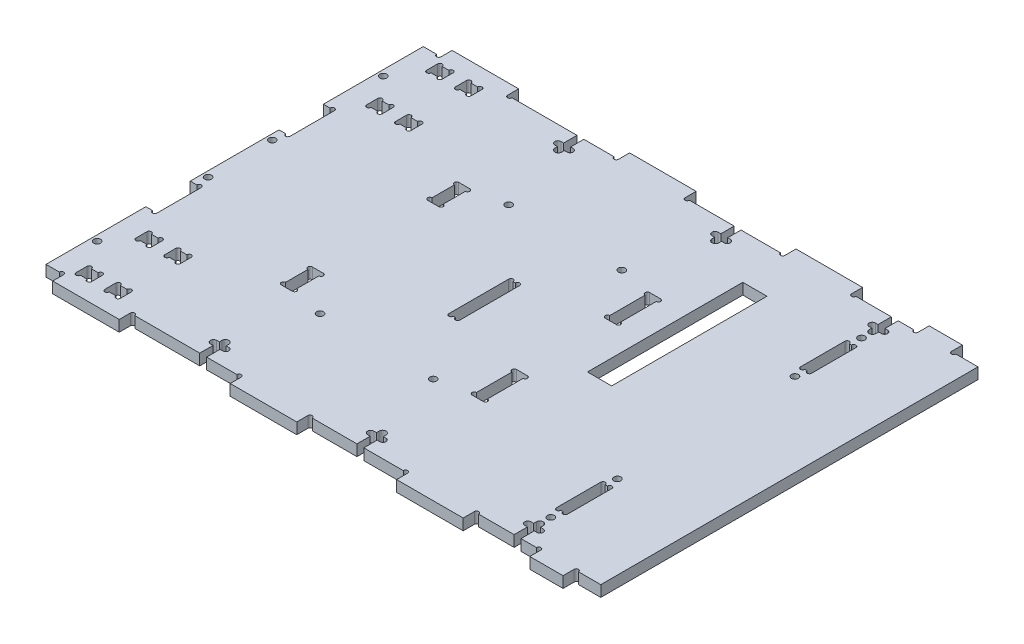
from build123d import *

# Parameters (mm, degrees)
SKETCH_1_W           = 250
SKETCH_1_H           = 170
EXTRUDE_1_DEPTH      = 5
SKETCH_2_W           = 5
SKETCH_2_H           = 27
SKETCH_2_H_2         = 20
CUT_EXTRUDE_1_DEPTH  = 10
SKETCH_3_R           = 1.55
CUT_EXTRUDE_2_DEPTH  = 10
SKETCH_4_W           = 5
SKETCH_4_H           = 20
CUT_EXTRUDE_3_DEPTH  = 5
SKETCH_5_R           = 1
CUT_EXTRUDE_4_DEPTH  = 10
CUT_EXTRUDE_5_DEPTH  = 10
SKETCH_8_W           = 30
SKETCH_8_H           = 5
SKETCH_8_W_2         = 15
EXTRUDE_2_DEPTH      = 5
SKETCH_9_R           = 1
CUT_EXTRUDE_6_DEPTH  = 5
SKETCH_13_W          = 7
SKETCH_13_H          = 5
CUT_EXTRUDE_9_DEPTH  = 10
SKETCH_14_R          = 1
CUT_EXTRUDE_10_DEPTH = 10
SKETCH_15_W          = 5
SKETCH_15_H          = 14
SKETCH_15_H_2        = 20
CUT_EXTRUDE_11_DEPTH = 10
SKETCH_16_R          = 1
CUT_EXTRUDE_12_DEPTH = 10
SKETCH_17_W          = 10.9
SKETCH_17_H          = 70
CUT_EXTRUDE_13_DEPTH = 10


with BuildPart() as part:
    # 스케치1 → 보스-돌출1 (new body)
    with BuildSketch(Plane(origin=(0, 0, 0), x_dir=(1, 0, 0), z_dir=(0, 1, 0))):
        with Locations((125, 85)):
            Rectangle(SKETCH_1_W, SKETCH_1_H)
    extrude(amount=EXTRUDE_1_DEPTH)

    # 스케치2 → 컷-돌출1 (cut)
    with BuildSketch(Plane.XZ):
        with Locations((112.5, -85)):
            Rectangle(SKETCH_2_W, SKETCH_2_H)
        with Locations((212.5, -30)):
            Rectangle(SKETCH_2_W, SKETCH_2_H_2)
        with Locations((212.5, -140)):
            Rectangle(SKETCH_2_W, SKETCH_2_H_2)
    extrude(amount=-CUT_EXTRUDE_1_DEPTH, mode=Mode.SUBTRACT)

    # 스케치3 → 컷-돌출2 (cut)
    with BuildSketch(Plane(origin=(0, 5, 0), x_dir=(1, 0, 0), z_dir=(0, 1, 0))):
        with Locations(Location((81, 127.5, 0), (0, 0, 270))):
            Circle(SKETCH_3_R)
        with Locations(Location((132, 127.5, 0), (0, 0, 270))):
            Circle(SKETCH_3_R)
        with Locations(Location((132, 42.5, 0), (0, 0, 270))):
            Circle(SKETCH_3_R)
        with Locations(Location((81, 42.5, 0), (0, 0, 270))):
            Circle(SKETCH_3_R)
        with Locations(Location((2.5, 70.55, 0), (0, 0, 270))):
            Circle(SKETCH_3_R)
        with Locations(Location((2.5, 20.55, 0), (0, 0, 270))):
            Circle(SKETCH_3_R)
        with Locations(Location((2.5, 99.45, 0), (0, 0, 270))):
            Circle(SKETCH_3_R)
        with Locations(Location((2.5, 149.45, 0), (0, 0, 270))):
            Circle(SKETCH_3_R)
        with Locations(Location((212.5, 155, 0), (0, 0, 270))):
            Circle(SKETCH_3_R)
        with Locations(Location((212.5, 125, 0), (0, 0, 270))):
            Circle(SKETCH_3_R)
        with Locations(Location((212.5, 15, 0), (0, 0, 270))):
            Circle(SKETCH_3_R)
        with Locations(Location((212.5, 45, 0), (0, 0, 270))):
            Circle(SKETCH_3_R)
    extrude(amount=-CUT_EXTRUDE_2_DEPTH, mode=Mode.SUBTRACT)

    # 스케치4 → 컷-돌출3 (cut)
    with BuildSketch(Plane.XZ):
        with Locations((2.5, -115)):
            Rectangle(SKETCH_4_W, SKETCH_4_H)
        with Locations((2.5, -55)):
            Rectangle(SKETCH_4_W, SKETCH_4_H)
    extrude(amount=-CUT_EXTRUDE_3_DEPTH, mode=Mode.SUBTRACT)

    # 스케치5 → 컷-돌출4 (cut)
    with BuildSketch(Plane.XZ):
        with Locations((4, -45)):
            Circle(SKETCH_5_R)
        with Locations((4, -65)):
            Circle(SKETCH_5_R)
        with Locations((4, -105)):
            Circle(SKETCH_5_R)
        with Locations((4, -125)):
            Circle(SKETCH_5_R)
        with Locations((114, -98.5)):
            Circle(SKETCH_5_R)
        with Locations((111, -98.5)):
            Circle(SKETCH_5_R)
        with Locations((114, -71.5)):
            Circle(SKETCH_5_R)
        with Locations((111, -71.5)):
            Circle(SKETCH_5_R)
        with Locations((214, -20)):
            Circle(SKETCH_5_R)
        with Locations((211, -20)):
            Circle(SKETCH_5_R)
        with Locations((214, -40)):
            Circle(SKETCH_5_R)
        with Locations((211, -40)):
            Circle(SKETCH_5_R)
        with Locations((214, -130)):
            Circle(SKETCH_5_R)
        with Locations((211, -130)):
            Circle(SKETCH_5_R)
        with Locations((214, -150)):
            Circle(SKETCH_5_R)
        with Locations((211, -150)):
            Circle(SKETCH_5_R)
    extrude(amount=-CUT_EXTRUDE_4_DEPTH, mode=Mode.SUBTRACT)

    # 스케치7 → 컷-돌출5 (cut)
    with BuildSketch(Plane.XZ):
        with BuildLine():
            Line((215.25, -8.8), (214.05, -8.8))
            Line((214.05, -8.8), (214.05, -9.999999282))
            ThreePointArc((214.05, -9.999999282), (212.500000359, -11.549999641), (210.95, -10))
            Line((210.95, -10), (210.95, -8.8))
            Line((210.95, -8.8), (209.75, -8.8))
            ThreePointArc((209.75, -8.8), (208.35, -7.4), (209.75, -6))
            Line((209.75, -6), (210.95, -6))
            Line((210.95, -6), (210.95, 0))
            Line((210.95, 0), (214.05, 0))
            Line((214.05, 0), (214.05, -6))
            Line((214.05, -6), (215.25, -6))
            ThreePointArc((215.25, -6), (216.65, -7.4), (215.25, -8.8))
        make_face()
        with BuildLine():
            Line((73.583333333, -8.8), (72.383333333, -8.8))
            Line((72.383333333, -8.8), (72.383333333, -10))
            ThreePointArc((72.383333333, -10), (70.833333333, -11.55), (69.283333333, -10))
            Line((69.283333333, -10), (69.283333333, -8.8))
            Line((69.283333333, -8.8), (68.083333333, -8.8))
            ThreePointArc((68.083333333, -8.8), (66.683333333, -7.4), (68.083333333, -6))
            Line((68.083333333, -6), (69.283333333, -6))
            Line((69.283333333, -6), (69.283333333, 0))
            Line((69.283333333, 0), (72.383333333, 0))
            Line((72.383333333, 0), (72.383333333, -6))
            Line((72.383333333, -6), (73.583333333, -6))
            ThreePointArc((73.583333333, -6), (74.983333333, -7.4), (73.583333333, -8.8))
        make_face()
        with BuildLine():
            Line((144.416666667, -8.8), (143.216666667, -8.8))
            Line((143.216666667, -8.8), (143.216666667, -10))
            ThreePointArc((143.216666667, -10), (141.666666667, -11.55), (140.116666667, -10))
            Line((140.116666667, -10), (140.116666667, -8.8))
            Line((140.116666667, -8.8), (138.916666667, -8.8))
            ThreePointArc((138.916666667, -8.8), (137.516666667, -7.4), (138.916666667, -6))
            Line((138.916666667, -6), (140.116666667, -6))
            Line((140.116666667, -6), (140.116666667, 0))
            Line((140.116666667, 0), (143.216666667, 0))
            Line((143.216666667, 0), (143.216666667, -6))
            Line((143.216666667, -6), (144.416666667, -6))
            ThreePointArc((144.416666667, -6), (145.816666667, -7.4), (144.416666667, -8.8))
        make_face()
        with BuildLine():
            Line((143.216666667, -170), (140.116666667, -170))
            Line((140.116666667, -170), (140.116666667, -164))
            Line((140.116666667, -164), (138.916666667, -164))
            ThreePointArc((138.916666667, -164), (137.516666667, -162.6), (138.916666667, -161.2))
            Line((138.916666667, -161.2), (140.116666667, -161.2))
            Line((140.116666667, -161.2), (140.116666667, -160))
            ThreePointArc((140.116666667, -160), (141.666666667, -158.45), (143.216666667, -160))
            Line((143.216666667, -160), (143.216666667, -161.2))
            Line((143.216666667, -161.2), (144.416666667, -161.2))
            ThreePointArc((144.416666667, -161.2), (145.816666667, -162.6), (144.416666667, -164))
            Line((144.416666667, -164), (143.216666667, -164))
            Line((143.216666667, -164), (143.216666667, -170))
        make_face()
        with BuildLine():
            Line((72.383333333, -170), (69.283333333, -170))
            Line((69.283333333, -170), (69.283333333, -164))
            Line((69.283333333, -164), (68.083333333, -164))
            ThreePointArc((68.083333333, -164), (66.683333333, -162.6), (68.083333333, -161.2))
            Line((68.083333333, -161.2), (69.283333333, -161.2))
            Line((69.283333333, -161.2), (69.283333333, -160))
            ThreePointArc((69.283333333, -160), (70.833333333, -158.45), (72.383333333, -160))
            Line((72.383333333, -160), (72.383333333, -161.2))
            Line((72.383333333, -161.2), (73.583333333, -161.2))
            ThreePointArc((73.583333333, -161.2), (74.983333333, -162.6), (73.583333333, -164))
            Line((73.583333333, -164), (72.383333333, -164))
            Line((72.383333333, -164), (72.383333333, -170))
        make_face()
        with BuildLine():
            Line((214.05, -170), (210.95, -170))
            Line((210.95, -170), (210.95, -164))
            Line((210.95, -164), (209.75, -164))
            ThreePointArc((209.75, -164), (208.35, -162.6), (209.75, -161.2))
            Line((209.75, -161.2), (210.95, -161.2))
            Line((210.95, -161.2), (210.95, -160))
            ThreePointArc((210.95, -160), (212.500000359, -158.450000359), (214.05, -160.000000718))
            Line((214.05, -160.000000718), (214.05, -161.2))
            Line((214.05, -161.2), (215.25, -161.2))
            ThreePointArc((215.25, -161.2), (216.65, -162.6), (215.25, -164))
            Line((215.25, -164), (214.05, -164))
            Line((214.05, -164), (214.05, -170))
        make_face()
    extrude(amount=-CUT_EXTRUDE_5_DEPTH, mode=Mode.SUBTRACT)

    # 스케치8 → 보스-돌출2 (add)
    with BuildSketch(Plane.XZ):
        with Locations((23, 2.5)):
            Rectangle(SKETCH_8_W, SKETCH_8_H)
        with Locations((103, 2.5)):
            Rectangle(SKETCH_8_W, SKETCH_8_H)
        with Locations((178, 2.5)):
            Rectangle(SKETCH_8_W, SKETCH_8_H)
        with Locations((230.5, 2.5)):
            Rectangle(SKETCH_8_W_2, SKETCH_8_H)
        with Locations((230.5, -172.5)):
            Rectangle(SKETCH_8_W_2, SKETCH_8_H)
        with Locations((178, -172.5)):
            Rectangle(SKETCH_8_W, SKETCH_8_H)
        with Locations((103, -172.5)):
            Rectangle(SKETCH_8_W, SKETCH_8_H)
        with Locations((23, -172.5)):
            Rectangle(SKETCH_8_W, SKETCH_8_H)
    extrude(amount=-EXTRUDE_2_DEPTH)

    # 스케치9 → 컷-돌출6 (cut)
    with BuildSketch(Plane.XZ):
        with Locations((7, 0)):
            Circle(SKETCH_9_R)
        with Locations((39, 0)):
            Circle(SKETCH_9_R)
        with Locations((87, 0)):
            Circle(SKETCH_9_R)
        with Locations((119, 0)):
            Circle(SKETCH_9_R)
        with Locations((162, 0)):
            Circle(SKETCH_9_R)
        with Locations((222, 0)):
            Circle(SKETCH_9_R)
        with Locations((194, 0)):
            Circle(SKETCH_9_R)
        with Locations((239, 0)):
            Circle(SKETCH_9_R)
        with Locations((239, -170)):
            Circle(SKETCH_9_R)
        with Locations((194, -170)):
            Circle(SKETCH_9_R)
        with Locations((222, -170)):
            Circle(SKETCH_9_R)
        with Locations((162, -170)):
            Circle(SKETCH_9_R)
        with Locations((119, -170)):
            Circle(SKETCH_9_R)
        with Locations((87, -170)):
            Circle(SKETCH_9_R)
        with Locations((39, -170)):
            Circle(SKETCH_9_R)
        with Locations((7, -170)):
            Circle(SKETCH_9_R)
    extrude(amount=-CUT_EXTRUDE_6_DEPTH, mode=Mode.SUBTRACT)

    # 스케치13 → 컷-돌출9 (cut)
    with BuildSketch(Plane(origin=(0, 5, 0), x_dir=(1, 0, 0), z_dir=(0, 1, 0))):
        with Locations((26.5, 6)):
            Rectangle(SKETCH_13_W, SKETCH_13_H)
        with Locations((13.5, 6)):
            Rectangle(SKETCH_13_W, SKETCH_13_H)
        with Locations((13.5, 33)):
            Rectangle(SKETCH_13_W, SKETCH_13_H)
        with Locations((26.5, 33)):
            Rectangle(SKETCH_13_W, SKETCH_13_H)
        with Locations((26.5, 137)):
            Rectangle(SKETCH_13_W, SKETCH_13_H)
        with Locations((13.5, 137)):
            Rectangle(SKETCH_13_W, SKETCH_13_H)
        with Locations((13.5, 164)):
            Rectangle(SKETCH_13_W, SKETCH_13_H)
        with Locations((26.5, 164)):
            Rectangle(SKETCH_13_W, SKETCH_13_H)
    extrude(amount=-CUT_EXTRUDE_9_DEPTH, mode=Mode.SUBTRACT)

    # 스케치14 → 컷-돌출10 (cut)
    with BuildSketch(Plane.XZ):
        with Locations((11, -8.5)):
            Circle(SKETCH_14_R)
        with Locations((11, -3.5)):
            Circle(SKETCH_14_R)
        with Locations((16, -3.5)):
            Circle(SKETCH_14_R)
        with Locations((16, -8.5)):
            Circle(SKETCH_14_R)
        with Locations((24, -8.5)):
            Circle(SKETCH_14_R)
        with Locations((24, -3.5)):
            Circle(SKETCH_14_R)
        with Locations((29, -3.5)):
            Circle(SKETCH_14_R)
        with Locations((29, -8.5)):
            Circle(SKETCH_14_R)
        with Locations((29, -30.5)):
            Circle(SKETCH_14_R)
        with Locations((29, -35.5)):
            Circle(SKETCH_14_R)
        with Locations((24, -35.5)):
            Circle(SKETCH_14_R)
        with Locations((24, -30.5)):
            Circle(SKETCH_14_R)
        with Locations((16, -30.5)):
            Circle(SKETCH_14_R)
        with Locations((16, -35.5)):
            Circle(SKETCH_14_R)
        with Locations((11, -35.5)):
            Circle(SKETCH_14_R)
        with Locations((11, -30.5)):
            Circle(SKETCH_14_R)
        with Locations((11, -139.5)):
            Circle(SKETCH_14_R)
        with Locations((11, -134.5)):
            Circle(SKETCH_14_R)
        with Locations((16, -134.5)):
            Circle(SKETCH_14_R)
        with Locations((16, -139.5)):
            Circle(SKETCH_14_R)
        with Locations((24, -139.5)):
            Circle(SKETCH_14_R)
        with Locations((24, -134.5)):
            Circle(SKETCH_14_R)
        with Locations((29, -134.5)):
            Circle(SKETCH_14_R)
        with Locations((29, -139.5)):
            Circle(SKETCH_14_R)
        with Locations((29, -161.5)):
            Circle(SKETCH_14_R)
        with Locations((29, -166.5)):
            Circle(SKETCH_14_R)
        with Locations((24, -166.5)):
            Circle(SKETCH_14_R)
        with Locations((24, -161.5)):
            Circle(SKETCH_14_R)
        with Locations((16, -161.5)):
            Circle(SKETCH_14_R)
        with Locations((16, -166.5)):
            Circle(SKETCH_14_R)
        with Locations((11, -166.5)):
            Circle(SKETCH_14_R)
        with Locations((11, -161.5)):
            Circle(SKETCH_14_R)
    extrude(amount=-CUT_EXTRUDE_10_DEPTH, mode=Mode.SUBTRACT)

    # 스케치15 → 컷-돌출11 (cut)
    with BuildSketch(Plane(origin=(0, 5, 0), x_dir=(1, 0, 0), z_dir=(0, 1, 0))):
        with Locations((63.5, 118)):
            Rectangle(SKETCH_15_W, SKETCH_15_H)
        with Locations((63.5, 52)):
            Rectangle(SKETCH_15_W, SKETCH_15_H)
        with Locations((149.5, 55)):
            Rectangle(SKETCH_15_W, SKETCH_15_H_2)
        with Locations((149.5, 115)):
            Rectangle(SKETCH_15_W, SKETCH_15_H_2)
    extrude(amount=-CUT_EXTRUDE_11_DEPTH, mode=Mode.SUBTRACT)

    # 스케치16 → 컷-돌출12 (cut)
    with BuildSketch(Plane(origin=(0, 5, 0), x_dir=(1, 0, 0), z_dir=(0, 1, 0))):
        with Locations((61, 46)):
            Circle(SKETCH_16_R)
        with Locations((66, 46)):
            Circle(SKETCH_16_R)
        with Locations((66, 58)):
            Circle(SKETCH_16_R)
        with Locations((61, 58)):
            Circle(SKETCH_16_R)
        with Locations((61, 112)):
            Circle(SKETCH_16_R)
        with Locations((66, 112)):
            Circle(SKETCH_16_R)
        with Locations((66, 124)):
            Circle(SKETCH_16_R)
        with Locations((61, 124)):
            Circle(SKETCH_16_R)
        with Locations((152, 124)):
            Circle(SKETCH_16_R)
        with Locations((147, 124)):
            Circle(SKETCH_16_R)
        with Locations((147, 64)):
            Circle(SKETCH_16_R)
        with Locations((152, 64)):
            Circle(SKETCH_16_R)
        with Locations((152, 106)):
            Circle(SKETCH_16_R)
        with Locations((147, 106)):
            Circle(SKETCH_16_R)
        with Locations((147, 46)):
            Circle(SKETCH_16_R)
        with Locations((152, 46)):
            Circle(SKETCH_16_R)
    extrude(amount=-CUT_EXTRUDE_12_DEPTH, mode=Mode.SUBTRACT)

    # 스케치17 → 컷-돌출13 (cut)
    with BuildSketch(Plane(origin=(0, 5, 0), x_dir=(1, 0, 0), z_dir=(0, 1, 0))):
        with Locations((169.45, 115)):
            Rectangle(SKETCH_17_W, SKETCH_17_H)
    extrude(amount=-CUT_EXTRUDE_13_DEPTH, mode=Mode.SUBTRACT)


solid = part.part
